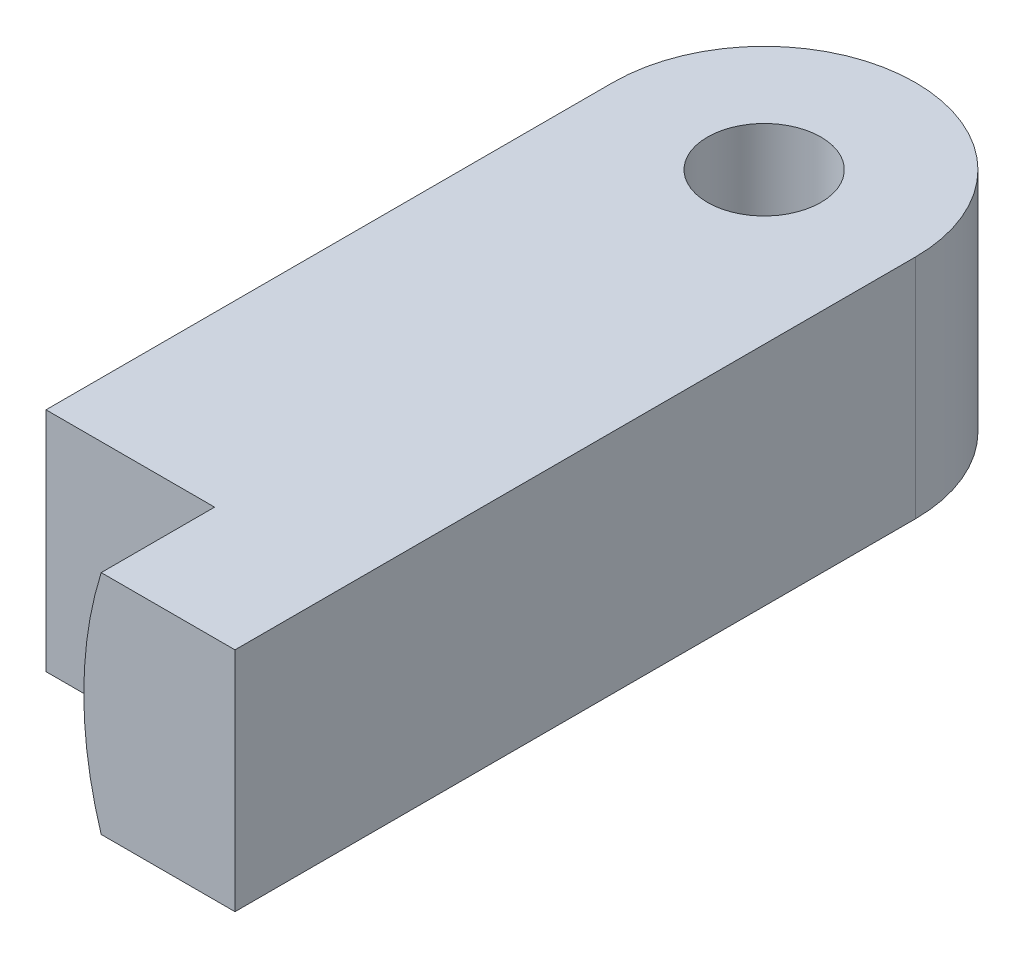
from build123d import *

# Parameters (mm, degrees)
CROQUIS1_W              = 8
CROQUIS1_H              = 6
SALIENTE_EXTRUIR1_DEPTH = 25
CROQUIS2_W              = 4
CROQUIS2_H              = 3
CORTAR_EXTRUIR1_DEPTH   = 27.019223663
CROQUIS3_R              = 1.5
CORTAR_EXTRUIR2_DEPTH   = 3
CROQUIS4_R              = 4
CROQUIS4_R_2            = 1.5
SALIENTE_EXTRUIR2_DEPTH = 3
CORTAR_EXTRUIR3_DEPTH   = 27.019223663
CORTAR_EXTRUIR4_DEPTH   = 3


with BuildPart() as part:
    # Croquis1 → Saliente-Extruir1 (new body)
    with BuildSketch(Plane.XY):
        Rectangle(CROQUIS1_W, CROQUIS1_H)
    extrude(amount=SALIENTE_EXTRUIR1_DEPTH)

    # Croquis2 → Cortar-Extruir1 (cut, through all)
    with BuildSketch(Plane(origin=(0, 3, 0), x_dir=(1, 0, 0), z_dir=(0, 1, 0))):
        with Locations((-2, -23.5)):
            Rectangle(CROQUIS2_W, CROQUIS2_H)
    extrude(amount=-CORTAR_EXTRUIR1_DEPTH, mode=Mode.SUBTRACT)

    # Croquis3 → Cortar-Extruir2 (cut)
    with BuildSketch(Plane.XZ.offset(3)):
        with Locations(Location((0, 7, 0), (0, 0, 270))):
            Circle(CROQUIS3_R)
    extrude(amount=-CORTAR_EXTRUIR2_DEPTH, mode=Mode.SUBTRACT)

    # Croquis4 → Saliente-Extruir2 (add)
    with BuildSketch(Plane.XZ.offset(3)):
        with Locations((0, 7)):
            Circle(CROQUIS4_R)
        with Locations(Location((0, 7, 0), (0, 0, 270))):
            Circle(CROQUIS4_R_2, mode=Mode.SUBTRACT)
    extrude(amount=-SALIENTE_EXTRUIR2_DEPTH)

    # Croquis5 → Cortar-Extruir3 (cut, through all)
    with BuildSketch(Plane(origin=(0, 3, 0), x_dir=(1, 0, 0), z_dir=(0, 1, 0))):
        with BuildLine():
            Line((4, 0), (-4, 0))
            Line((-4, 0), (-4, -7))
            ThreePointArc((-4, -7), (0, -3), (4, -7))
            Line((4, -7), (4, 0))
        make_face()
        with BuildLine():
            ThreePointArc((1.5, -7), (0, -5.5), (-1.5, -7))
            Line((-1.5, -7), (1.5, -7))
        make_face()
        with BuildLine():
            Line((1.5, -7), (-1.5, -7))
            ThreePointArc((-1.5, -7), (0, -8.5), (1.5, -7))
        make_face()
    extrude(amount=-CORTAR_EXTRUIR3_DEPTH, mode=Mode.SUBTRACT)

    # Croquis6 → Cortar-Extruir4 (cut)
    with BuildSketch(Plane.XY.offset(25)):
        with BuildLine():
            Line((0, 3), (0, 0))
            ThreePointArc((0, 0), (0.115822742, 1.517576993), (0.460607986, 3))
            Line((0.460607986, 3), (0, 3))
        make_face()
        with BuildLine():
            Line((0, 0), (0, -3))
            Line((0, -3), (0.460607986, -3))
            ThreePointArc((0.460607986, -3), (0.115822742, -1.517576993), (0, 0))
        make_face()
    extrude(amount=-CORTAR_EXTRUIR4_DEPTH, mode=Mode.SUBTRACT)


solid = part.part
